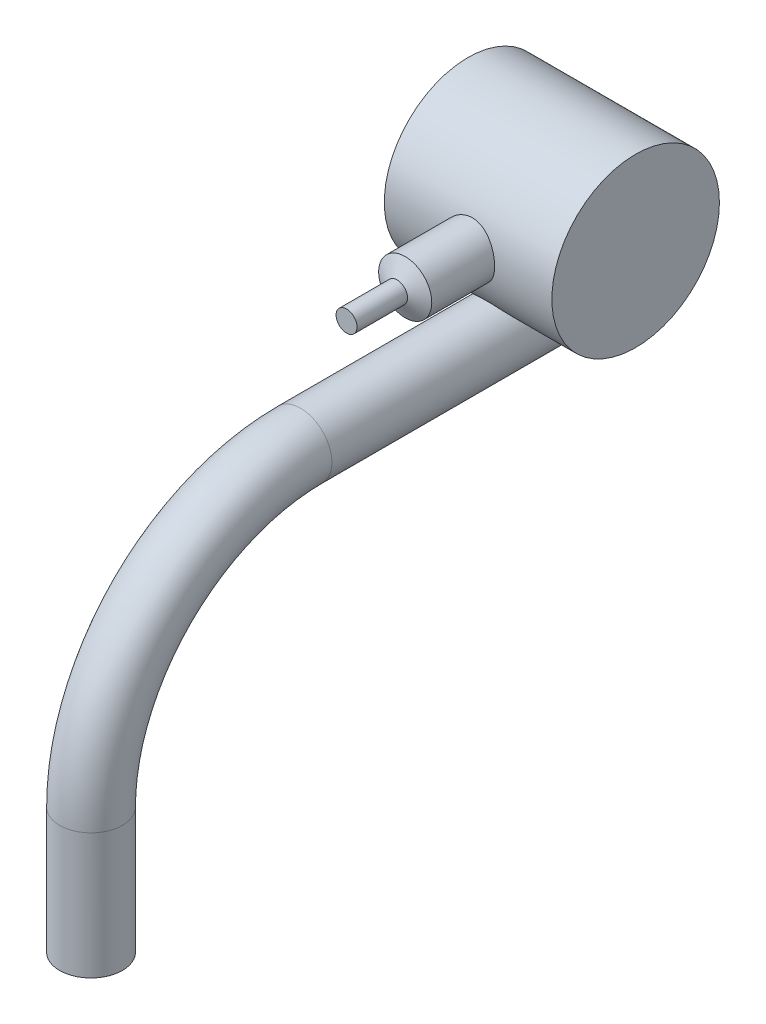
from build123d import *

# Parameters (mm, degrees)
SKETCH1_R      = 12.7
EXTRUDE1_DEPTH = 12.7
SKETCH2_R      = 4.7625
SKETCH2_R_2    = 3.8735
EXTRUDE2_START = 0.889
SKETCH4_R      = 4.7625
EXTRUDE2_DEPTH = 0.889


with BuildPart() as part:
    # Sketch1 → Extrude1 (new, symmetric)
    with BuildSketch(Plane(origin=(0, 0, 0), x_dir=(0, 0, -1), z_dir=(1, 0, 0))):
        Circle(SKETCH1_R)
    extrude(amount=EXTRUDE1_DEPTH, both=True)

    # Sweep1: sweep along a path in Sketch3
    with BuildLine(Plane(origin=(0, 0, 0), x_dir=(0, 0, -1), z_dir=(1, 0, 0))) as sweep1_path:
        Line((12.7, -12.7), (-38.1, -12.7))
        ThreePointArc((-38.1, -12.7), (-60.550640303, -21.999359697), (-69.85, -44.45))
        Line((-69.85, -44.45), (-69.85, -63.5))
    # Sketch2 → Sweep1 (sweep)
    with BuildSketch(Plane.XY.offset(-12.7)):
        with Locations((0, -12.7)):
            Circle(SKETCH2_R)
        with Locations((0, -12.7)):
            Circle(SKETCH2_R_2, mode=Mode.SUBTRACT)
    sweep(path=sweep1_path.line)

    # Sketch4 → Extrude2 (add)
    with BuildSketch(Plane.XY.offset(-12.7).offset(EXTRUDE2_START)):
        with Locations(Location((0, -12.7, 0), (0, 0, 90))):
            Circle(SKETCH4_R)
    extrude(amount=-EXTRUDE2_DEPTH)

    # Sketch5 → Revolve1 (revolve)
    with BuildSketch(Plane(origin=(0, 0, 0), x_dir=(0, 0, -1), z_dir=(1, 0, 0))):
        Polygon((-10.16, 0), (-31.115, 0), (-31.115, 1.5875), (-23.462887774, 1.5875), (-22.225, 4.0259), (-10.16, 4.0259), align=None)
    revolve(axis=Axis((0, 0, 31.115), (0, 0, 1)))


solid = part.part
